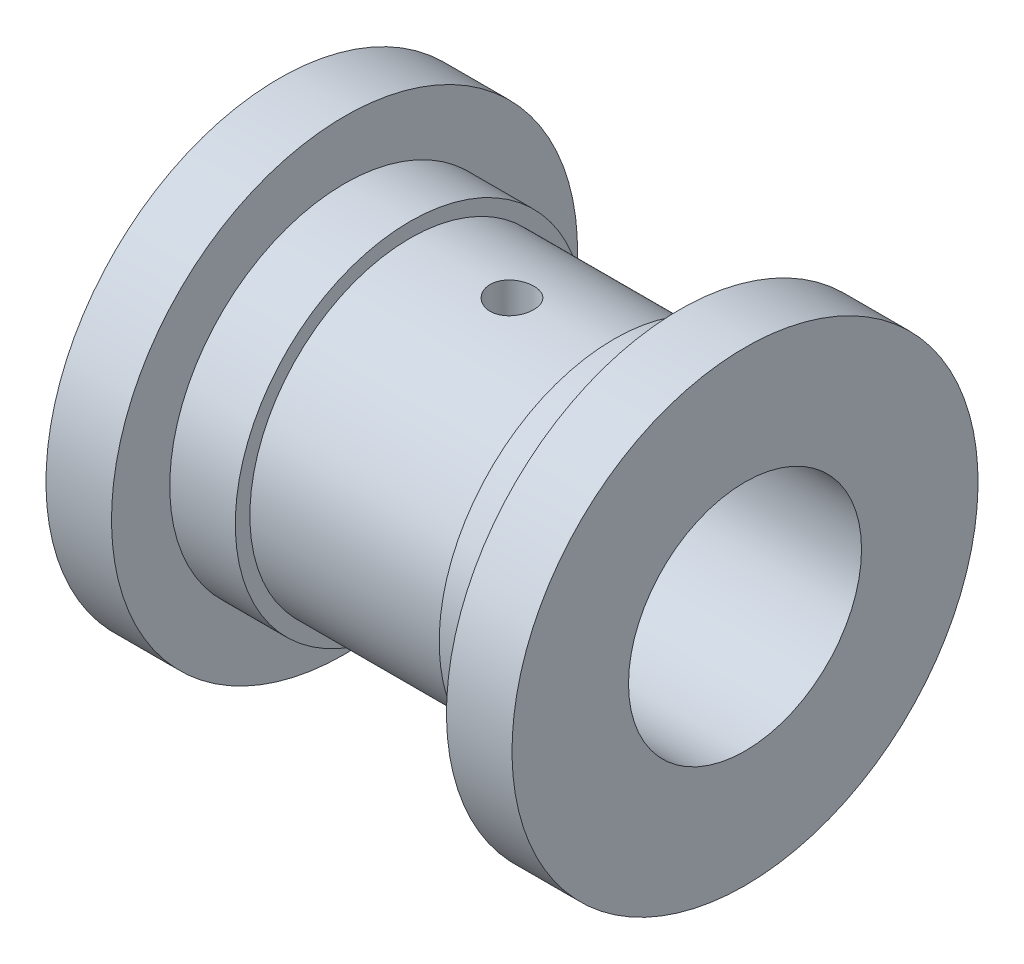
from build123d import *
from build123d.topology import SkipClean

# Parameters (mm, degrees)
CUT_EXTRUDE1_DEPTH                   = 56.425625842
CUT_EXTRUDE1_DEPTH_BACK              = 56.425625842
SKETCH2_R                            = 3
BOSS_EXTRUDE1_START                  = -22
SKETCH2_3_R                          = 4
SKETCH2_3_R_2                        = 3
BOSS_EXTRUDE1_DEPTH                  = 8
BOSS_EXTRUDE1_DIRECTION_2_REACH      = 79.426
BOSS_EXTRUDE1_DIRECTION_2_END_RADIUS = 22


with BuildPart() as part:
    # Sketch1 → Revolve1 (revolve)
    with BuildSketch(Plane.XY, mode=Mode.PRIVATE) as revolve1_sk:
        Polygon((-32, 16), (-32, 32), (-23, 32), (-23, 24), (-14, 24), (-14, 22), (14, 22), (14, 24), (23, 24), (23, 32), (32, 32), (32, 16), align=None)
    revolve(revolve1_sk.sketch.rotate(Axis((-82.802720484, 0, 0), (1, 0, 0)), 180), axis=Axis((-82.802720484, 0, 0), (1, 0, 0)))

    # Sketch2 → Cut-Extrude1 (cut, two sides: drawn at the far end of the back side and taken through both)
    with BuildSketch(Plane(origin=(0, 0, 0), x_dir=(1, 0, 0), z_dir=(0, 1, 0)).offset(-CUT_EXTRUDE1_DEPTH_BACK)):
        with Locations(Location((0, 0, 0), (0, 0, 270))):
            Circle(SKETCH2_R)
    extrude(amount=CUT_EXTRUDE1_DEPTH + CUT_EXTRUDE1_DEPTH_BACK, mode=Mode.SUBTRACT)

    # Sketch2<3> → Boss-Extrude1 (add)
    with BuildSketch(Plane(origin=(0, 0, 0), x_dir=(1, 0, 0), z_dir=(0, 1, 0)).offset(BOSS_EXTRUDE1_START)):
        with Locations(Location((0, 0, 0), (0, 0, 270))):
            Circle(SKETCH2_3_R)
        with Locations(Location((0, 0, 0), (0, 0, 270))):
            Circle(SKETCH2_3_R_2, mode=Mode.SUBTRACT)
    extrude(amount=-BOSS_EXTRUDE1_DEPTH)

    # Boss-Extrude1 direction 2: up to this cylinder (the profile starts outside it)
    with SkipClean():  # the faces are left unmerged after this step: merging them gives an invalid solid
        boss_extrude1_direction_2_end = Plane(origin=(0, 0, 0), z_dir=(-1, 0, 0)) * Cylinder(BOSS_EXTRUDE1_DIRECTION_2_END_RADIUS, 203.852, mode=Mode.PRIVATE)
        # Sketch2<3> → Boss-Extrude1 direction 2 (add, up to the surface)
        with BuildSketch(Plane(origin=(0, 0, 0), x_dir=(1, 0, 0), z_dir=(0, 1, 0)).offset(BOSS_EXTRUDE1_START), mode=Mode.PRIVATE) as boss_extrude1_direction_2_sk1:
            with Locations(Location((0, 0, 0), (0, 0, 270))):
                Circle(SKETCH2_3_R)
            with Locations(Location((0, 0, 0), (0, 0, 270))):
                Circle(SKETCH2_3_R_2, mode=Mode.SUBTRACT)
        boss_extrude1_direction_2_tool1 = extrude(boss_extrude1_direction_2_sk1.sketch, amount=BOSS_EXTRUDE1_DIRECTION_2_REACH, mode=Mode.PRIVATE) - boss_extrude1_direction_2_end
        add(boss_extrude1_direction_2_tool1.solids().sort_by_distance((0, -22, -3.886863))[0])
        add(boss_extrude1_direction_2_tool1.solids().sort_by_distance((0, -22, -3.886863))[1])


solid = part.part
